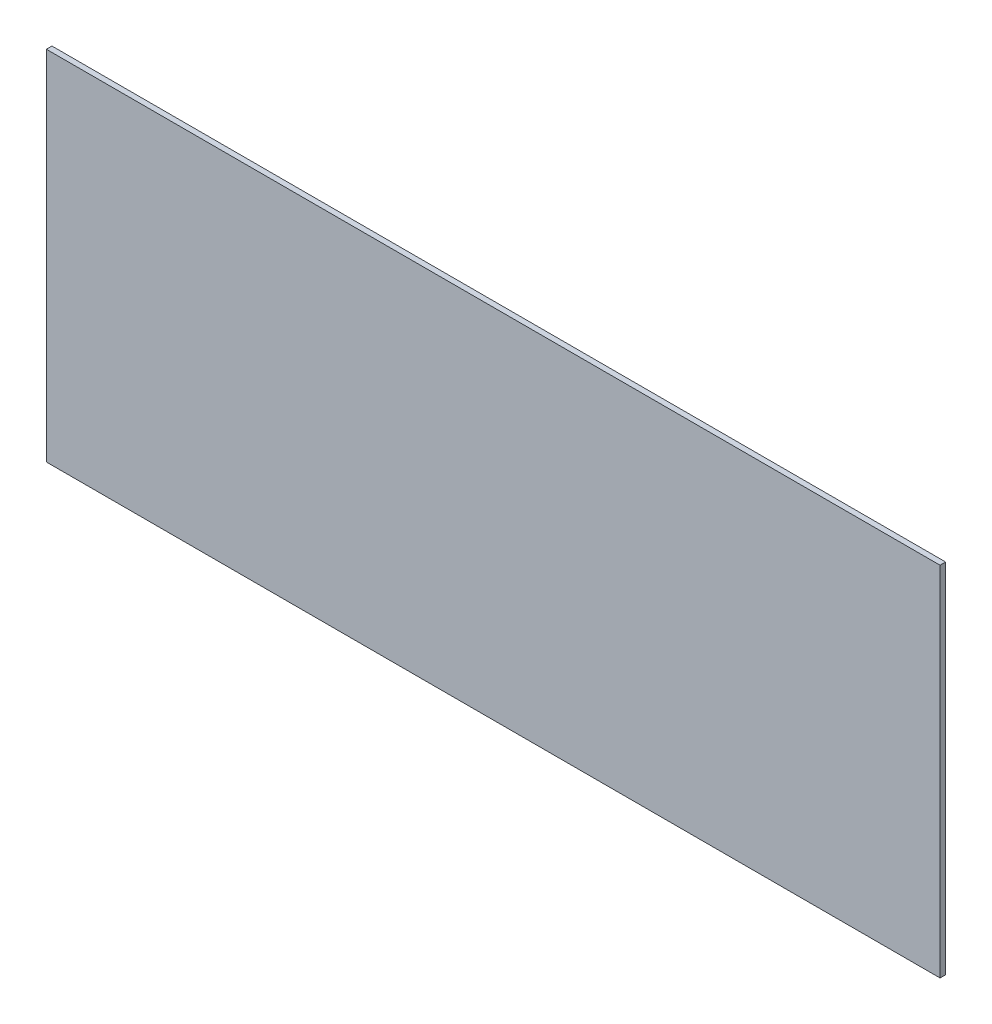
from build123d import *

# Parameters (mm, degrees)
SKETCH1_W           = 127
SKETCH1_H           = 50.8
BOSS_EXTRUDE1_DEPTH = 0.79375


with BuildPart() as part:
    # Sketch1 → Boss-Extrude1 (new body)
    with BuildSketch(Plane.XY):
        Rectangle(SKETCH1_W, SKETCH1_H)
    extrude(amount=BOSS_EXTRUDE1_DEPTH)


solid = part.part
